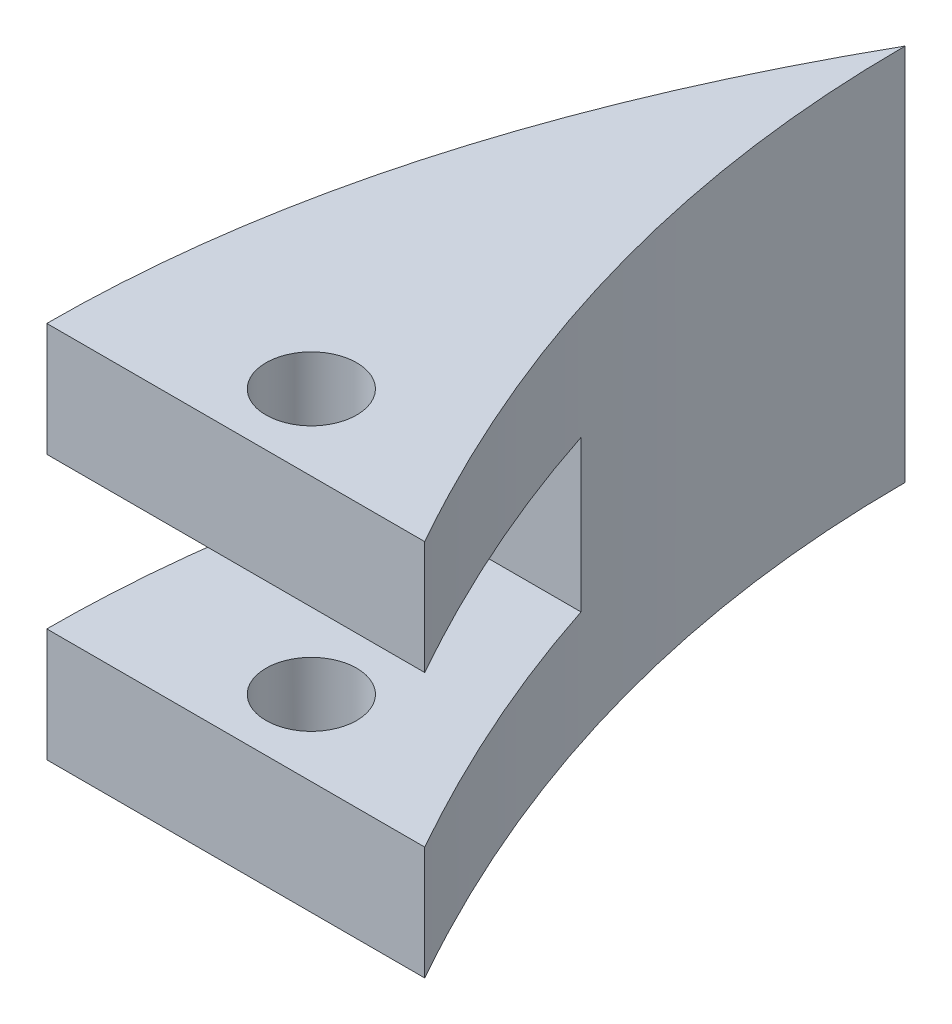
from build123d import *

# Parameters (mm, degrees)
SKETCH_1_W          = 25
SKETCH_1_H          = 25
EXTRUDE_1_DEPTH     = 44.284173786
SKETCH_2_R          = 3
CUT_EXTRUDE_1_DEPTH = 36.344532851
SKETCH_4_W          = 25
SKETCH_4_H          = 10
CUT_EXTRUDE_2_DEPTH = 18.639834826
CUT_EXTRUDE_4_DEPTH = 30


with BuildPart() as part:
    # 스케치1 → 보스-돌출1 (new body)
    with BuildSketch(Plane.XY):
        Rectangle(SKETCH_1_W, SKETCH_1_H)
    extrude(amount=EXTRUDE_1_DEPTH)

    # 스케치2 → 컷-돌출1 (cut)
    with BuildSketch(Plane(origin=(0, 12.5, 0), x_dir=(1, 0, 0), z_dir=(0, 1, 0))):
        with Locations(Location((0, -39.284173786, 0), (0, 0, 270))):
            Circle(SKETCH_2_R)
    extrude(amount=-CUT_EXTRUDE_1_DEPTH, mode=Mode.SUBTRACT)

    # 스케치4 → 컷-돌출2 (cut)
    with BuildSketch(Plane.XY.offset(44.284173786)):
        Rectangle(SKETCH_4_W, SKETCH_4_H)
    extrude(amount=-CUT_EXTRUDE_2_DEPTH, mode=Mode.SUBTRACT)

    # 스케치5 → 컷-돌출4 (cut)
    with BuildSketch(Plane(origin=(0, 12.5, 0), x_dir=(1, 0, 0), z_dir=(0, 1, 0))):
        with BuildLine():
            add(Edge.make_bspline(
                [(0, 0), (-0.013056864, -22.058961494), (12.5, -44.284173786)],
                knots=[0, 0, 0, 1, 1, 1], degree=2))
            Line((12.5, -44.284173786), (12.5, 0))
            Line((12.5, 0), (0, 0))
        make_face()
        with BuildLine():
            add(Edge.make_bspline(
                [(0, 0), (-12.5, -22.142086893), (-12.5, -44.284173786)],
                knots=[0, 0, 0, 1, 1, 1], degree=2))
            Line((0, 0), (-12.5, 0))
            Line((-12.5, 0), (-12.5, -44.284173786))
        make_face()
    extrude(amount=-CUT_EXTRUDE_4_DEPTH, mode=Mode.SUBTRACT)


solid = part.part
